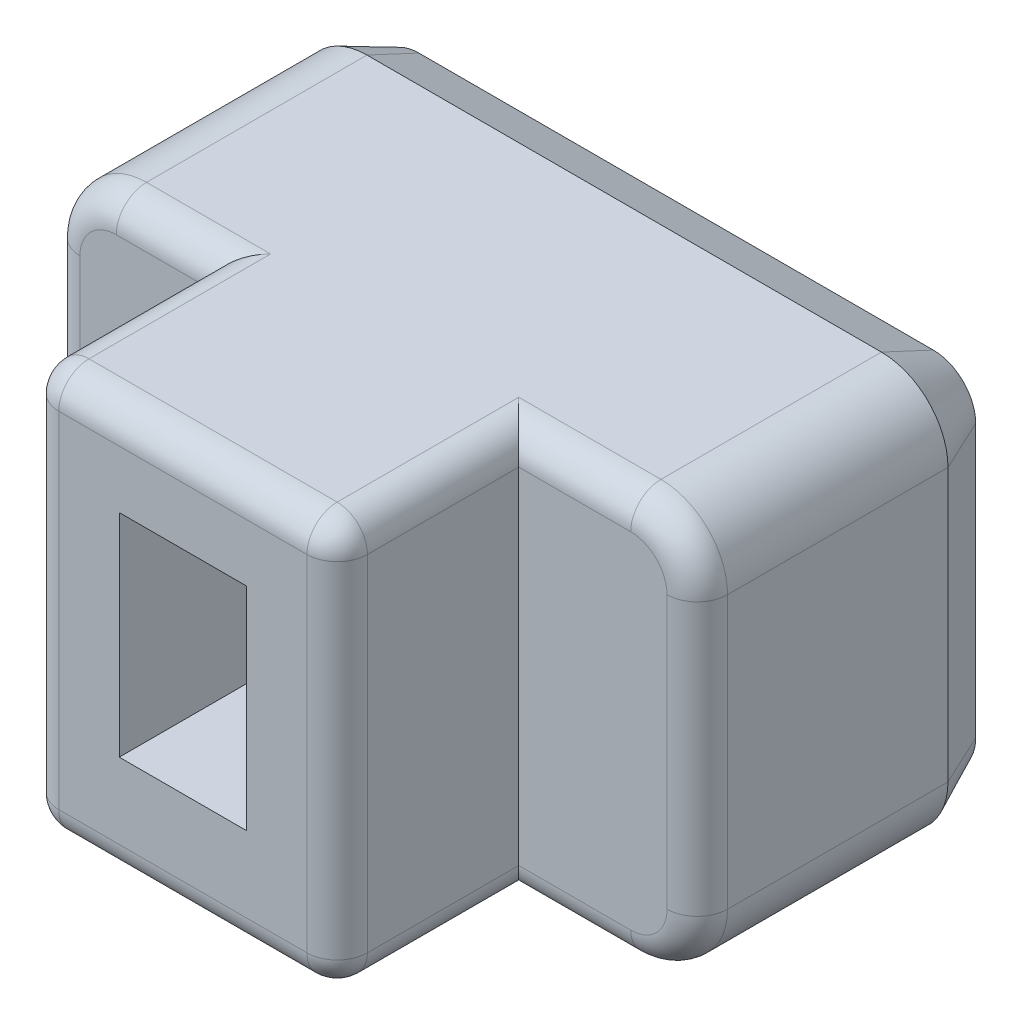
from build123d import *

# Parameters (mm, degrees)
BOSS_EXTRU_1_DEPTH      = 8
ESQUISSE3_W             = 2.1
ESQUISSE3_H             = 3.5
ENL_V_MAT_EXTRU_1_DEPTH = 3
ESQUISSE4_OUTSIDE_W     = 15.69
ESQUISSE4_OUTSIDE_H     = 11.69
ESQUISSE4_OUTSIDE_W_2   = 5.1
ESQUISSE4_OUTSIDE_H_2   = 6.7
ENL_V_MAT_EXTRU_2_DEPTH = 3
CONG_1_R                = 0.5
CHANFREIN1_SIZE         = 0.4
CHANFREIN1_SIZE2        = 0.857802768
ENL_V_MAT_EXTRU_3_DEPTH = 0.3
BOSS_EXTRU_2_START      = -0.2
BOSS_EXTRU_2_DEPTH      = 0.2
BOSS_EXTRU_2_2_DEPTH    = 0.2


with BuildPart() as part:
    # Esquisse2 → Boss.-Extru.1 (new body)
    with BuildSketch(Plane.XY):
        with BuildLine():
            Line((1.1, 0), (9.6, 0))
            ThreePointArc((9.6, 0), (10.377817459, 0.322182541), (10.7, 1.1))
            Line((10.7, 1.1), (10.7, 5.6))
            ThreePointArc((10.7, 5.6), (10.377817459, 6.377817459), (9.6, 6.7))
            Line((9.6, 6.7), (1.1, 6.7))
            ThreePointArc((1.1, 6.7), (0.322182541, 6.377817459), (0, 5.6))
            Line((0, 5.6), (0, 1.1))
            ThreePointArc((0, 1.1), (0.322182541, 0.322182541), (1.1, 0))
        make_face()
    extrude(amount=BOSS_EXTRU_1_DEPTH)

    # Esquisse3 → Enlèv. mat.-Extru.1 (cut)
    with BuildSketch(Plane.XY.offset(8)):
        with Locations((5.2, 3.5)):
            Rectangle(ESQUISSE3_W, ESQUISSE3_H)
    extrude(amount=-ENL_V_MAT_EXTRU_1_DEPTH, mode=Mode.SUBTRACT)

    # Esquisse4 outside → Enlèv. mat.-Extru.2 (cut)
    with BuildSketch(Plane.XY.offset(8)):
        with Locations((5.35, 3.35)):
            Rectangle(ESQUISSE4_OUTSIDE_W, ESQUISSE4_OUTSIDE_H)
        with Locations((5.2, 3.35)):
            Rectangle(ESQUISSE4_OUTSIDE_W_2, ESQUISSE4_OUTSIDE_H_2, mode=Mode.SUBTRACT)
    extrude(amount=-ENL_V_MAT_EXTRU_2_DEPTH, mode=Mode.SUBTRACT)

    # Congé1
    cong_1_edges = [part.edges().sort_by_distance(p)[0] for p in [
        (8.675, 0, 5),
        (10.377817459, 0.322182541, 5),
        (10.7, 3.35, 5),
        (10.377817459, 6.377817459, 5),
        (1.875, 6.7, 5),
        (0.322182541, 6.377817459, 5),
        (1.875, 0, 5),
        (0.322182541, 0.322182541, 5),
        (7.75, 6.7, 6.5),
        (2.65, 6.7, 6.5),
        (7.75, 0, 6.5),
        (2.65, 0, 6.5),
        (2.65, 3.35, 8),
        (5.2, 6.7, 8),
        (7.75, 3.35, 8),
        (5.2, 0, 8),
        (8.675, 6.7, 5),
        (0, 3.35, 5),
    ]]
    fillet(cong_1_edges, radius=CONG_1_R)

    # Chanfrein1
    chanfrein1_edges = [part.edges().sort_by_distance(p)[0] for p in [
        (5.35, 0, 0),
        (10.377817459, 0.322182541, 0),
        (0.322182541, 0.322182541, 0),
        (10.7, 3.35, 0),
        (0, 3.35, 0),
        (10.377817459, 6.377817459, 0),
        (0.322182541, 6.377817459, 0),
        (5.35, 6.7, 0),
    ]]
    chanfrein1_side = [part.faces().sort_by_distance(p)[0] for p in [
        (5.35, 3.35, 0),
    ]]
    chamfer(chanfrein1_edges, length=CHANFREIN1_SIZE, length2=CHANFREIN1_SIZE2, reference=chanfrein1_side[0])

    # Esquisse5 → Enlèv. mat.-Extru.3 (cut)
    # profile 1 of 2: a face of its own
    with BuildSketch(Plane.XY.offset(0.2)):
        Polygon((3.609407587, 1.094662367), (5.686330664, 5.594662367), (5.24732826, 5.594662367), (4.582063837, 4.152354675), (2.542099894, 4.152354675), (1.857905183, 5.594662367), (1.417099894, 5.594662367), (3.551715279, 1.094662367), align=None)
        Polygon((3.576054221, 1.971765732), (2.761150375, 3.690816213), (4.369323452, 3.690816213), align=None, mode=Mode.SUBTRACT)
    # profile 2 of 2: a face of its own
    with BuildSketch(Plane.XY.offset(0.2)):
        with BuildLine():
            Line((6.378638356, 1.094662367), (7.261150375, 1.094662367))
            add(Edge.make_bspline(
                [(7.261150375, 1.094662367), (7.321850112, 1.094729091), (7.438153502, 1.094856936), (7.604930002, 1.098733038), (7.756399657, 1.103910214), (7.892235861, 1.111086933), (8.012856559, 1.119568264), (8.117715944, 1.131463743), (8.207638231, 1.143884123), (8.261517952, 1.156511646), (8.286090279, 1.16227054)],
                knots=[0, 0, 0, 0, 1.415646017, 2.712440637, 3.8905458, 4.950247383, 5.884950622, 6.709939814, 7.411656543, 8, 8, 8, 8], degree=3))
            add(Edge.make_bspline(
                [(8.286090279, 1.16227054), (8.317196053, 1.170784732), (8.378674633, 1.187612491), (8.467264548, 1.221312133), (8.551537448, 1.261288715), (8.63184584, 1.30678277), (8.70681395, 1.359942744), (8.778782426, 1.417700422), (8.846241985, 1.482391663), (8.90817401, 1.553931294), (8.965556705, 1.629975705), (9.013590134, 1.712463989), (9.056005542, 1.798534592), (9.089060256, 1.890288955), (9.11504253, 1.986515933), (9.133965449, 2.087465974), (9.146127613, 2.192921305), (9.14728165, 2.265000756), (9.147869125, 2.301693617)],
                knots=[0, 0, 0, 0, 0.999333726, 1.975119402, 2.933498163, 3.889020618, 4.832249799, 5.779334906, 6.747801194, 7.724875447, 8.710438469, 9.696133548, 10.679360639, 11.681339199, 12.714023775, 13.766351759, 14.862936069, 16, 16, 16, 16], degree=3))
            add(Edge.make_bspline(
                [(9.147869125, 2.301693617), (9.147327293, 2.338693616), (9.146267163, 2.411086612), (9.133543367, 2.516994483), (9.11640455, 2.618203841), (9.090051197, 2.714490278), (9.055535331, 2.805281983), (9.015045549, 2.891966424), (8.966209581, 2.973068859), (8.9100948, 3.048883724), (8.847671322, 3.119482183), (8.779203258, 3.184352633), (8.704967025, 3.243115354), (8.625198549, 3.295902082), (8.539120172, 3.341488727), (8.448037403, 3.382319547), (8.351158553, 3.416610911), (8.284118178, 3.434649561), (8.250032587, 3.443821021)],
                knots=[0, 0, 0, 0, 1.121902311, 2.195077645, 3.232258892, 4.234102512, 5.217864754, 6.176164875, 7.132989551, 8.084763148, 9.034132444, 9.988522005, 10.94243251, 11.903244335, 12.886203696, 13.894208494, 14.929344452, 16, 16, 16, 16], degree=3))
            add(Edge.make_bspline(
                [(8.250032587, 3.443821021), (8.221839979, 3.449811814), (8.16005424, 3.462940986), (8.058305692, 3.477697807), (7.939780035, 3.489800013), (7.804880545, 3.501093889), (7.653292641, 3.507078231), (7.485363993, 3.514104825), (7.300526272, 3.51742029), (7.171607725, 3.517629869), (7.104299414, 3.51773929)],
                knots=[0, 0, 0, 0, 0.601372724, 1.317943291, 2.144091499, 3.08771165, 4.142394186, 5.309582461, 6.595334295, 8, 8, 8, 8], degree=3))
            Line((7.104299414, 3.51773929), (6.78248451, 3.51773929))
            Line((6.78248451, 3.51773929), (6.78248451, 5.594662367))
            Line((6.78248451, 5.594662367), (6.378638356, 5.594662367))
            Line((6.378638356, 5.594662367), (6.378638356, 1.094662367))
        make_face()
        with BuildLine():
            Line((6.78248451, 1.556200828), (6.78248451, 3.056200828))
            Line((6.78248451, 3.056200828), (7.570345087, 3.066116694))
            add(Edge.make_bspline(
                [(7.570345087, 3.066116694), (7.60881421, 3.066142059), (7.68307806, 3.066191026), (7.79064413, 3.060979305), (7.89020037, 3.055309541), (7.98189377, 3.046140185), (8.065305816, 3.034956429), (8.140638461, 3.020003691), (8.208492895, 3.004752864), (8.286653689, 2.978289974), (8.374201975, 2.938367344), (8.469222869, 2.87873792), (8.550410431, 2.803619839), (8.620073259, 2.718247361), (8.675136967, 2.623174032), (8.715044023, 2.521733537), (8.739402461, 2.414311062), (8.74246411, 2.340882961), (8.744022971, 2.303496501)],
                knots=[0, 0, 0, 0, 1.160501667, 2.240324542, 3.248665471, 4.168823117, 5.020172044, 5.786515869, 6.485785279, 7.116517804, 8.272762037, 9.381837012, 10.485674779, 11.594342068, 12.695271952, 13.786226926, 14.872841088, 16, 16, 16, 16], degree=3))
            add(Edge.make_bspline(
                [(8.744022971, 2.303496501), (8.742394563, 2.267321259), (8.739157489, 2.195409356), (8.715245232, 2.089966092), (8.674714339, 1.989678817), (8.620028368, 1.895359033), (8.552034907, 1.810213463), (8.472461997, 1.736769489), (8.382547671, 1.677325191), (8.299560485, 1.637753689), (8.225293489, 1.614548079), (8.161096425, 1.597794804), (8.088242579, 1.586240426), (8.007421418, 1.575185059), (7.918736422, 1.566260973), (7.821623663, 1.560063802), (7.716406617, 1.556474967), (7.643364796, 1.55629442), (7.605501337, 1.556200828)],
                knots=[0, 0, 0, 0, 1.12039168, 2.227199994, 3.330242575, 4.460839274, 5.593542475, 6.693949254, 7.801736126, 8.92216649, 9.528704869, 10.210659466, 10.975987387, 11.81211542, 12.738540127, 13.736887663, 14.826846554, 16, 16, 16, 16], degree=3))
            Line((7.605501337, 1.556200828), (6.78248451, 1.556200828))
        make_face(mode=Mode.SUBTRACT)
    extrude(amount=-ENL_V_MAT_EXTRU_3_DEPTH, mode=Mode.SUBTRACT)


with BuildPart() as body_2:
    # Esquisse5<3> → Boss.-Extru.2 (new body)
    with BuildSketch(Plane.XY.offset(0.2).offset(BOSS_EXTRU_2_START)):
        Polygon((3.609407587, 1.094662367), (5.686330664, 5.594662367), (5.24732826, 5.594662367), (4.582063837, 4.152354675), (2.542099894, 4.152354675), (1.857905183, 5.594662367), (1.417099894, 5.594662367), (3.551715279, 1.094662367), align=None)
        Polygon((3.576054221, 1.971765732), (2.761150375, 3.690816213), (4.369323452, 3.690816213), align=None, mode=Mode.SUBTRACT)
    extrude(amount=-BOSS_EXTRU_2_DEPTH)


with BuildPart() as body_3:
    # Esquisse5<3> → Boss.-Extru.2 2 (new body)
    with BuildSketch(Plane.XY.offset(0.2).offset(BOSS_EXTRU_2_START)):
        with BuildLine():
            Line((6.378638356, 1.094662367), (7.261150375, 1.094662367))
            add(Edge.make_bspline(
                [(7.261150375, 1.094662367), (7.321850112, 1.094729091), (7.438153502, 1.094856936), (7.604930002, 1.098733038), (7.756399657, 1.103910214), (7.892235861, 1.111086933), (8.012856559, 1.119568264), (8.117715944, 1.131463743), (8.207638231, 1.143884123), (8.261517952, 1.156511646), (8.286090279, 1.16227054)],
                knots=[0, 0, 0, 0, 1.415646017, 2.712440637, 3.8905458, 4.950247383, 5.884950622, 6.709939814, 7.411656543, 8, 8, 8, 8], degree=3))
            add(Edge.make_bspline(
                [(8.286090279, 1.16227054), (8.317196053, 1.170784732), (8.378674633, 1.187612491), (8.467264548, 1.221312133), (8.551537448, 1.261288715), (8.63184584, 1.30678277), (8.70681395, 1.359942744), (8.778782426, 1.417700422), (8.846241985, 1.482391663), (8.90817401, 1.553931294), (8.965556705, 1.629975705), (9.013590134, 1.712463989), (9.056005542, 1.798534592), (9.089060256, 1.890288955), (9.11504253, 1.986515933), (9.133965449, 2.087465974), (9.146127613, 2.192921305), (9.14728165, 2.265000756), (9.147869125, 2.301693617)],
                knots=[0, 0, 0, 0, 0.999333726, 1.975119402, 2.933498163, 3.889020618, 4.832249799, 5.779334906, 6.747801194, 7.724875447, 8.710438469, 9.696133548, 10.679360639, 11.681339199, 12.714023775, 13.766351759, 14.862936069, 16, 16, 16, 16], degree=3))
            add(Edge.make_bspline(
                [(9.147869125, 2.301693617), (9.147327293, 2.338693616), (9.146267163, 2.411086612), (9.133543367, 2.516994483), (9.11640455, 2.618203841), (9.090051197, 2.714490278), (9.055535331, 2.805281983), (9.015045549, 2.891966424), (8.966209581, 2.973068859), (8.9100948, 3.048883724), (8.847671322, 3.119482183), (8.779203258, 3.184352633), (8.704967025, 3.243115354), (8.625198549, 3.295902082), (8.539120172, 3.341488727), (8.448037403, 3.382319547), (8.351158553, 3.416610911), (8.284118178, 3.434649561), (8.250032587, 3.443821021)],
                knots=[0, 0, 0, 0, 1.121902311, 2.195077645, 3.232258892, 4.234102512, 5.217864754, 6.176164875, 7.132989551, 8.084763148, 9.034132444, 9.988522005, 10.94243251, 11.903244335, 12.886203696, 13.894208494, 14.929344452, 16, 16, 16, 16], degree=3))
            add(Edge.make_bspline(
                [(8.250032587, 3.443821021), (8.221839979, 3.449811814), (8.16005424, 3.462940986), (8.058305692, 3.477697807), (7.939780035, 3.489800013), (7.804880545, 3.501093889), (7.653292641, 3.507078231), (7.485363993, 3.514104825), (7.300526272, 3.51742029), (7.171607725, 3.517629869), (7.104299414, 3.51773929)],
                knots=[0, 0, 0, 0, 0.601372724, 1.317943291, 2.144091499, 3.08771165, 4.142394186, 5.309582461, 6.595334295, 8, 8, 8, 8], degree=3))
            Line((7.104299414, 3.51773929), (6.78248451, 3.51773929))
            Line((6.78248451, 3.51773929), (6.78248451, 5.594662367))
            Line((6.78248451, 5.594662367), (6.378638356, 5.594662367))
            Line((6.378638356, 5.594662367), (6.378638356, 1.094662367))
        make_face()
        with BuildLine():
            Line((6.78248451, 1.556200828), (6.78248451, 3.056200828))
            Line((6.78248451, 3.056200828), (7.570345087, 3.066116694))
            add(Edge.make_bspline(
                [(7.570345087, 3.066116694), (7.60881421, 3.066142059), (7.68307806, 3.066191026), (7.79064413, 3.060979305), (7.89020037, 3.055309541), (7.98189377, 3.046140185), (8.065305816, 3.034956429), (8.140638461, 3.020003691), (8.208492895, 3.004752864), (8.286653689, 2.978289974), (8.374201975, 2.938367344), (8.469222869, 2.87873792), (8.550410431, 2.803619839), (8.620073259, 2.718247361), (8.675136967, 2.623174032), (8.715044023, 2.521733537), (8.739402461, 2.414311062), (8.74246411, 2.340882961), (8.744022971, 2.303496501)],
                knots=[0, 0, 0, 0, 1.160501667, 2.240324542, 3.248665471, 4.168823117, 5.020172044, 5.786515869, 6.485785279, 7.116517804, 8.272762037, 9.381837012, 10.485674779, 11.594342068, 12.695271952, 13.786226926, 14.872841088, 16, 16, 16, 16], degree=3))
            add(Edge.make_bspline(
                [(8.744022971, 2.303496501), (8.742394563, 2.267321259), (8.739157489, 2.195409356), (8.715245232, 2.089966092), (8.674714339, 1.989678817), (8.620028368, 1.895359033), (8.552034907, 1.810213463), (8.472461997, 1.736769489), (8.382547671, 1.677325191), (8.299560485, 1.637753689), (8.225293489, 1.614548079), (8.161096425, 1.597794804), (8.088242579, 1.586240426), (8.007421418, 1.575185059), (7.918736422, 1.566260973), (7.821623663, 1.560063802), (7.716406617, 1.556474967), (7.643364796, 1.55629442), (7.605501337, 1.556200828)],
                knots=[0, 0, 0, 0, 1.12039168, 2.227199994, 3.330242575, 4.460839274, 5.593542475, 6.693949254, 7.801736126, 8.92216649, 9.528704869, 10.210659466, 10.975987387, 11.81211542, 12.738540127, 13.736887663, 14.826846554, 16, 16, 16, 16], degree=3))
            Line((7.605501337, 1.556200828), (6.78248451, 1.556200828))
        make_face(mode=Mode.SUBTRACT)
    extrude(amount=-BOSS_EXTRU_2_2_DEPTH)


solid = Compound([part.part, body_2.part, body_3.part])
